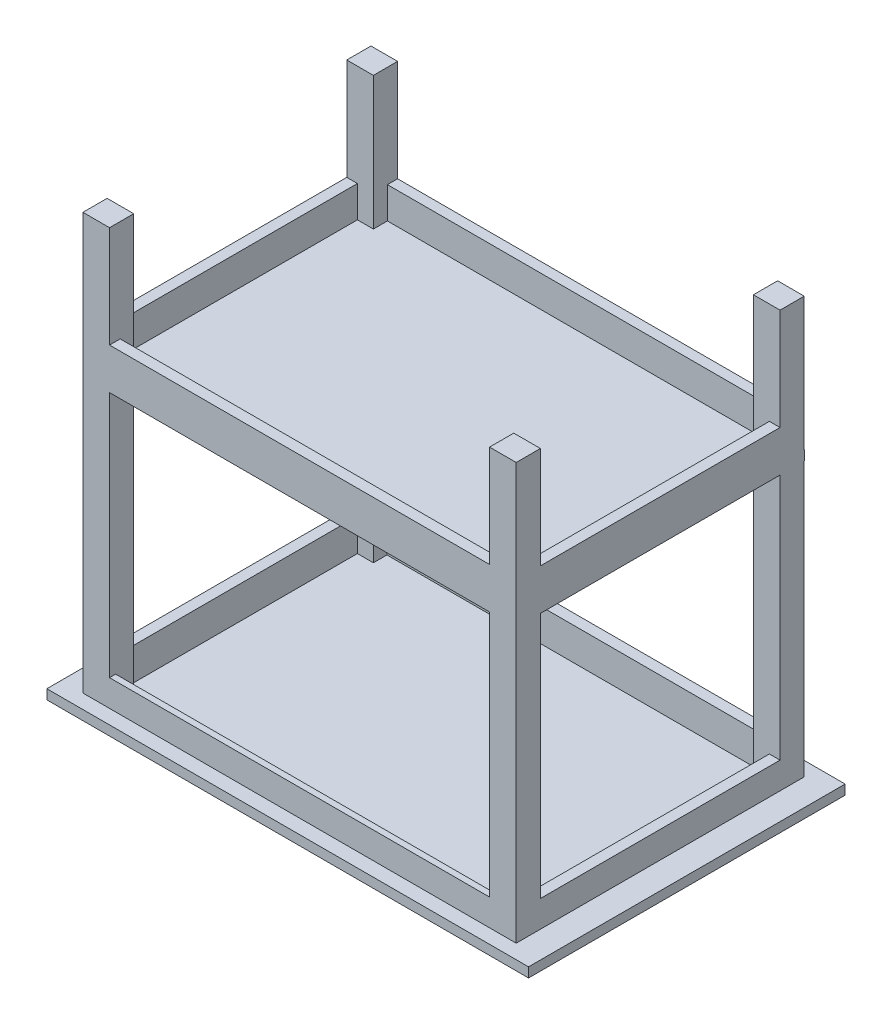
from build123d import *

# Parameters (mm, degrees)
CROQUIS2_W              = 995
CROQUIS2_H              = 654
SALIENTE_EXTRUIR1_DEPTH = 20
CROQUIS4_W              = 895
CROQUIS4_H              = 595
SALIENTE_EXTRUIR2_DEPTH = 75
CROQUIS6_W              = 851
CROQUIS6_H              = 560.386984293
CORTAR_EXTRUIR1_DEPTH   = 67
CROQUIS7_W              = 55
CROQUIS7_H              = 50
SALIENTE_EXTRUIR3_DEPTH = 880
CROQUIS9_W              = 55
CROQUIS9_H              = 50
SALIENTE_EXTRUIR5_DEPTH = 880
CROQUIS10_W             = 55
CROQUIS10_H             = 50
SALIENTE_EXTRUIR6_DEPTH = 880
CROQUIS11_W             = 55
CROQUIS11_H             = 50
SALIENTE_EXTRUIR7_DEPTH = 880
CROQUIS14_W             = 895
CROQUIS14_H             = 20
EXTRUIR_L_MINA4_DEPTH   = 596
CROQUIS22_W             = 895
CROQUIS22_H             = 595
SALIENTE_EXTRUIR8_DEPTH = 65
CROQUIS25_W             = 851
CROQUIS25_H             = 495
CORTAR_EXTRUIR2_DEPTH   = 65
CROQUIS26_W             = 785
CROQUIS26_H             = 552
CORTAR_EXTRUIR3_DEPTH   = 65


with BuildPart() as part:
    # Croquis2 → Saliente-Extruir1 (new body)
    with BuildSketch(Plane(origin=(0, 0, 0), x_dir=(1, 0, 0), z_dir=(0, 1, 0))):
        with Locations((0.447794779, -19.364986499)):
            Rectangle(CROQUIS2_W, CROQUIS2_H)
    extrude(amount=SALIENTE_EXTRUIR1_DEPTH)

    # Croquis4 → Saliente-Extruir2 (add)
    with BuildSketch(Plane(origin=(0, 0, 0), x_dir=(1, 0, 0), z_dir=(0, 1, 0))):
        with Locations((-4.552205221, -19.364986499)):
            Rectangle(CROQUIS4_W, CROQUIS4_H)
    extrude(amount=SALIENTE_EXTRUIR2_DEPTH)

    # Croquis6 → Cortar-Extruir1 (cut)
    with BuildSketch(Plane(origin=(0, 75, 0), x_dir=(1, 0, 0), z_dir=(0, 1, 0))):
        with Locations((-4.552205221, -24.058478646)):
            Rectangle(CROQUIS6_W, CROQUIS6_H)
    extrude(amount=-CORTAR_EXTRUIR1_DEPTH, mode=Mode.SUBTRACT)

    # Croquis7 → Saliente-Extruir3 (add)
    with BuildSketch(Plane(origin=(0, 0, 0), x_dir=(1, 0, 0), z_dir=(0, 1, 0))):
        with Locations((-424.552205221, -291.864986499)):
            Rectangle(CROQUIS7_W, CROQUIS7_H)
    extrude(amount=SALIENTE_EXTRUIR3_DEPTH)

    # Croquis9 → Saliente-Extruir5 (add)
    with BuildSketch(Plane(origin=(0, 0, 0), x_dir=(1, 0, 0), z_dir=(0, 1, 0))):
        with Locations((-424.552205221, 253.135013501)):
            Rectangle(CROQUIS9_W, CROQUIS9_H)
    extrude(amount=SALIENTE_EXTRUIR5_DEPTH)

    # Croquis10 → Saliente-Extruir6 (add)
    with BuildSketch(Plane(origin=(0, 0, 0), x_dir=(1, 0, 0), z_dir=(0, 1, 0))):
        with Locations((415.447794779, 253.135013501)):
            Rectangle(CROQUIS10_W, CROQUIS10_H)
    extrude(amount=SALIENTE_EXTRUIR6_DEPTH)

    # Croquis11 → Saliente-Extruir7 (add)
    with BuildSketch(Plane(origin=(0, 0, 0), x_dir=(1, 0, 0), z_dir=(0, 1, 0))):
        with Locations((415.447794779, -291.864986499)):
            Rectangle(CROQUIS11_W, CROQUIS11_H)
    extrude(amount=SALIENTE_EXTRUIR7_DEPTH)

    # Croquis14 → Extruir-Lámina4 (add)
    with BuildSketch(Plane.XY.offset(316.864986499)):
        with Locations((-4.552205221, 595)):
            Rectangle(CROQUIS14_W, CROQUIS14_H)
    extrude(amount=-EXTRUIR_L_MINA4_DEPTH)

    # Croquis22 → Saliente-Extruir8 (add)
    with BuildSketch(Plane(origin=(0, 605, 0), x_dir=(1, 0, 0), z_dir=(0, 1, 0))):
        with Locations((-4.552205221, -19.364986499)):
            Rectangle(CROQUIS22_W, CROQUIS22_H)
    extrude(amount=SALIENTE_EXTRUIR8_DEPTH)

    # Croquis25 → Cortar-Extruir2 (cut)
    with BuildSketch(Plane(origin=(0, 670, 0), x_dir=(1, 0, 0), z_dir=(0, 1, 0))):
        with Locations((-4.552205221, -19.364986499)):
            Rectangle(CROQUIS25_W, CROQUIS25_H)
    extrude(amount=-CORTAR_EXTRUIR2_DEPTH, mode=Mode.SUBTRACT)

    # Croquis26 → Cortar-Extruir3 (cut)
    with BuildSketch(Plane(origin=(0, 670, 0), x_dir=(1, 0, 0), z_dir=(0, 1, 0))):
        with Locations((-4.552205221, -18.864986499)):
            Rectangle(CROQUIS26_W, CROQUIS26_H)
    extrude(amount=-CORTAR_EXTRUIR3_DEPTH, mode=Mode.SUBTRACT)


solid = part.part
